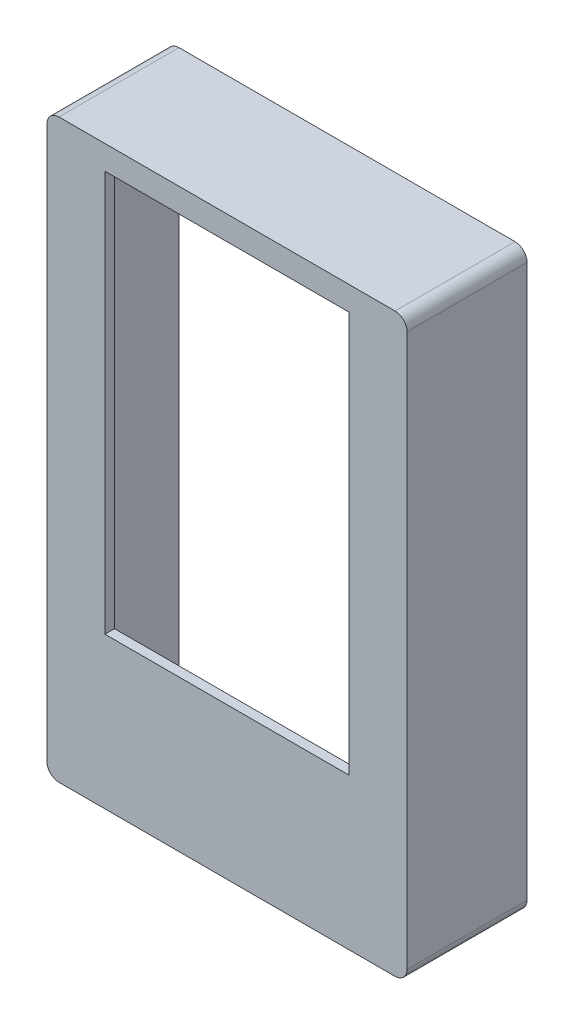
from build123d import *

# Parameters (mm, degrees)
ESQUISSE1_W             = 150
ESQUISSE1_H             = 240
BOSS_EXTRU_1_DEPTH      = 50
ESQUISSE2_W             = 140
ESQUISSE2_H             = 230
ENL_V_MAT_EXTRU_1_DEPTH = 46
ESQUISSE3_W             = 101.7
ESQUISSE3_H             = 167
ENL_V_MAT_EXTRU_2_DEPTH = 151.083310198
CONG_1_R                = 5


with BuildPart() as part:
    # Esquisse1 → Boss.-Extru.1 (new body)
    with BuildSketch(Plane.XY):
        Rectangle(ESQUISSE1_W, ESQUISSE1_H)
    extrude(amount=BOSS_EXTRU_1_DEPTH)

    # Esquisse2 → Enlèv. mat.-Extru.1 (cut)
    with BuildSketch(Plane(origin=(0, 0, 0), x_dir=(-1, 0, 0), z_dir=(0, 0, -1))):
        Rectangle(ESQUISSE2_W, ESQUISSE2_H)
    extrude(amount=-ENL_V_MAT_EXTRU_1_DEPTH, mode=Mode.SUBTRACT)

    # Esquisse3 → Enlèv. mat.-Extru.2 (cut, through all)
    with BuildSketch(Plane.XY.offset(50)):
        with Locations((0, 26.5)):
            Rectangle(ESQUISSE3_W, ESQUISSE3_H)
    extrude(amount=-ENL_V_MAT_EXTRU_2_DEPTH, mode=Mode.SUBTRACT)

    # Congé1
    cong_1_edges = [part.edges().sort_by_distance(p)[0] for p in [
        (75, -120, 25),
        (-75, -120, 25),
        (-75, 120, 25),
        (75, 120, 25),
    ]]
    fillet(cong_1_edges, radius=CONG_1_R)


solid = part.part
